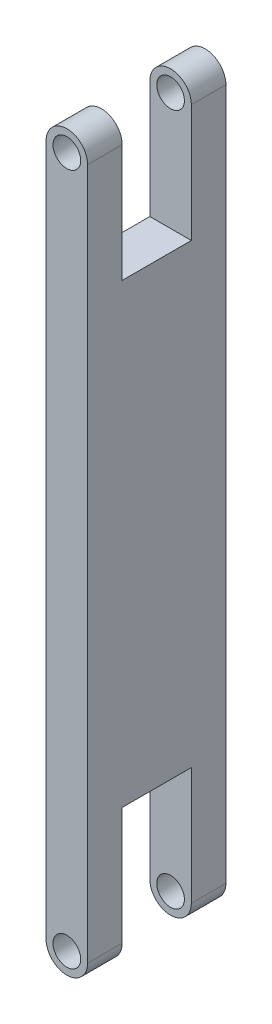
from build123d import *

# Parameters (mm, degrees)
EXTRUDE_1_DEPTH     = 50
SKETCH_2_W          = 25
SKETCH_2_H          = 50
CUT_EXTRUDE_1_DEPTH = 263.737987356
SKETCH_3_R          = 5
CUT_EXTRUDE_2_DEPTH = 263.416653435


with BuildPart() as part:
    # 草图1 → 凸台-拉伸1 (new body)
    with BuildSketch(Plane.XY):
        with BuildLine():
            Line((-7.5, 0), (-7.5, 250))
            ThreePointArc((-7.5, 250), (0, 257.5), (7.5, 250))
            Line((7.5, 250), (7.5, 0))
            ThreePointArc((7.5, 0), (0, -7.5), (-7.5, 0))
        make_face()
    extrude(amount=EXTRUDE_1_DEPTH)

    # 草图2 → 切除-拉伸1 (cut, through all)
    with BuildSketch(Plane(origin=(7.5, 0, 0), x_dir=(0, 0, -1), z_dir=(1, 0, 0))):
        with Locations((-25, 232.5)):
            Rectangle(SKETCH_2_W, SKETCH_2_H)
        with Locations((-25, 17.5)):
            Rectangle(SKETCH_2_W, SKETCH_2_H)
    extrude(amount=-CUT_EXTRUDE_1_DEPTH, mode=Mode.SUBTRACT)

    # 草图3 → 切除-拉伸2 (cut, through all)
    with BuildSketch(Plane.XY.offset(50)):
        with Locations((0, 250)):
            Circle(SKETCH_3_R)
        Circle(SKETCH_3_R)
    extrude(amount=-CUT_EXTRUDE_2_DEPTH, mode=Mode.SUBTRACT)


solid = part.part
